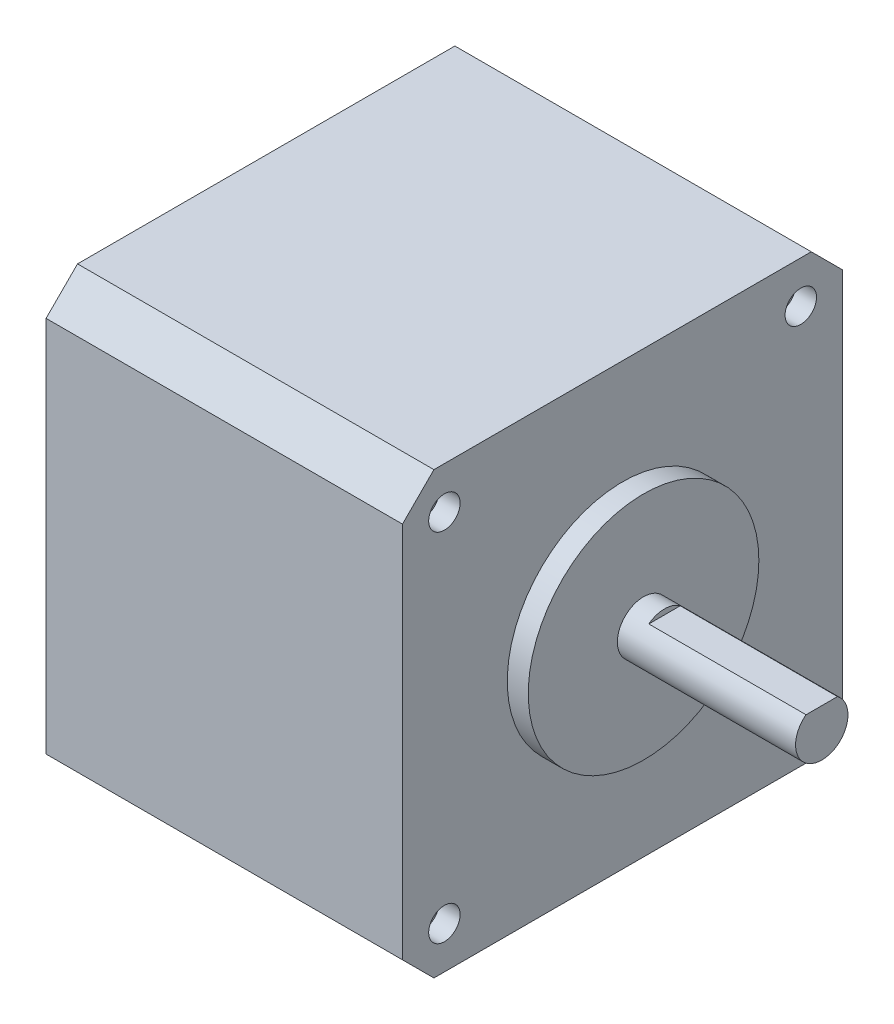
from build123d import *

# Parameters (mm, degrees)
SKETCH1_W           = 34
SKETCH1_H           = 42
BOSS_EXTRUDE1_DEPTH = 42
SKETCH2_R           = 11
BOSS_EXTRUDE2_DEPTH = 2
SKETCH3_R           = 2.5
BOSS_EXTRUDE3_DEPTH = 2
BOSS_EXTRUDE4_DEPTH = 15
CHAMFER1_SIZE       = 3
SKETCH5_R           = 1.5
CUT_EXTRUDE1_DEPTH  = 2


with BuildPart() as part:
    # Sketch1 → Boss-Extrude1 (new body)
    with BuildSketch(Plane(origin=(0, 0, 0), x_dir=(1, 0, 0), z_dir=(0, 1, 0))):
        Rectangle(SKETCH1_W, SKETCH1_H)
    extrude(amount=BOSS_EXTRUDE1_DEPTH)

    # Sketch2 → Boss-Extrude2 (add)
    with BuildSketch(Plane(origin=(17, 0, 0), x_dir=(0, 0, -1), z_dir=(1, 0, 0))):
        with Locations((0, 21)):
            Circle(SKETCH2_R)
    extrude(amount=BOSS_EXTRUDE2_DEPTH)

    # Sketch3 → Boss-Extrude3 (add)
    with BuildSketch(Plane(origin=(19, 0, 0), x_dir=(0, 0, -1), z_dir=(1, 0, 0))):
        with Locations((0, 21)):
            Circle(SKETCH3_R)
    extrude(amount=BOSS_EXTRUDE3_DEPTH)

    # Sketch4 → Boss-Extrude4 (add)
    with BuildSketch(Plane(origin=(21, 0, 0), x_dir=(0, 0, -1), z_dir=(1, 0, 0))):
        with BuildLine():
            Line((1.5, 23), (-1.5, 23))
            ThreePointArc((-1.5, 23), (0, 18.5), (1.5, 23))
        make_face()
    extrude(amount=BOSS_EXTRUDE4_DEPTH)

    # Chamfer1
    chamfer1_edges = [part.edges().sort_by_distance(p)[0] for p in [
        (0, 42, -21),
        (0, 0, -21),
        (0, 0, 21),
        (0, 42, 21),
    ]]
    chamfer(chamfer1_edges, length=CHAMFER1_SIZE)

    # Sketch5 → Cut-Extrude1 (cut)
    with BuildSketch(Plane(origin=(17, 0, 0), x_dir=(0, 0, -1), z_dir=(1, 0, 0))):
        with Locations((-17, 38)):
            Circle(SKETCH5_R)
        with Locations((-17, 4)):
            Circle(SKETCH5_R)
        with Locations((17, 4)):
            Circle(SKETCH5_R)
        with Locations((17, 38)):
            Circle(SKETCH5_R)
    cut_extrude1 = extrude(amount=-CUT_EXTRUDE1_DEPTH, mode=Mode.SUBTRACT)

    # Mirror1: Cut-Extrude1 across plane
    add(cut_extrude1.mirror(Plane(origin=(0, 0, 0), x_dir=(0, 0, 1), z_dir=(1, 0, 0))), mode=Mode.SUBTRACT)


solid = part.part
